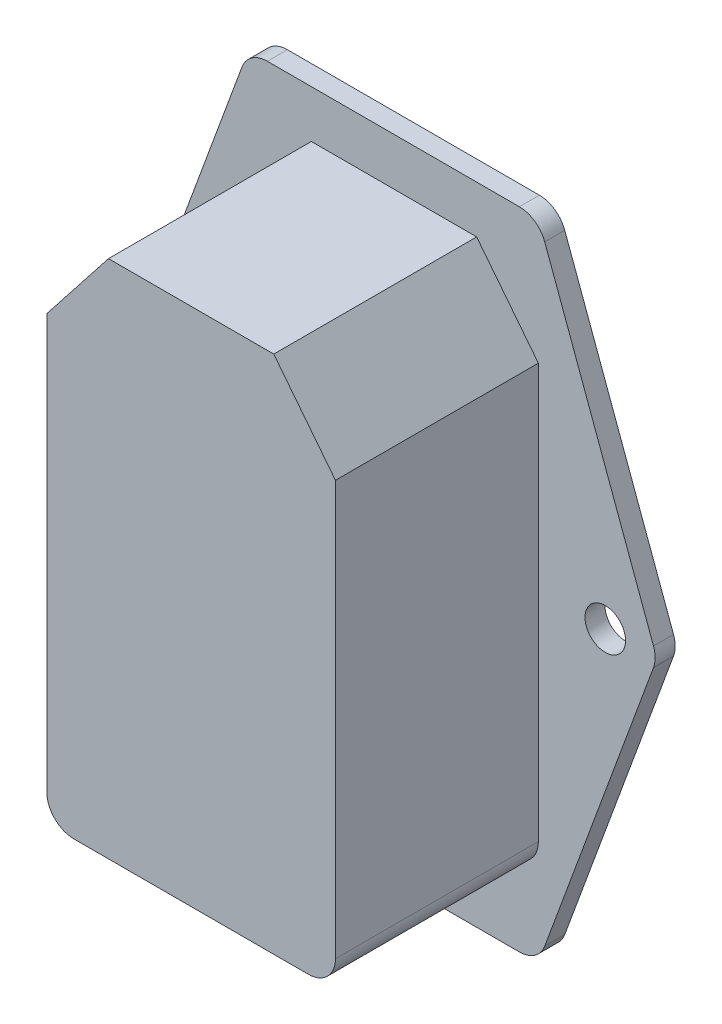
from build123d import *

# Parameters (mm, degrees)
BOSS_EXTRUDE1_DEPTH     = 19.05
BOSS_EXTRUDE2_DEPTH     = 1.8796
CUT_EXTRUDE1_DEPTH      = 22.606
CUT_EXTRUDE1_DEPTH_BACK = 20.4216
SKETCH6_R               = 1.905


with BuildPart() as part:
    # Sketch1 → Boss-Extrude1 (new body)
    with BuildSketch(Plane.XY):
        with BuildLine():
            Line((2.54, 0), (24.5618, 0))
            ThreePointArc((24.5618, 0), (26.357851224, 0.743948776), (27.1018, 2.54))
            Line((27.1018, 2.54), (27.1018, 41.4401))
            Line((27.1018, 41.4401), (21.3106, 48.809471297))
            Line((21.3106, 48.809471297), (5.7912, 48.809471297))
            Line((5.7912, 48.809471297), (0, 41.4401))
            Line((0, 41.4401), (0, 2.54))
            ThreePointArc((0, 2.54), (0.743948776, 0.743948776), (2.54, 0))
        make_face()
    extrude(amount=BOSS_EXTRUDE1_DEPTH)

    # Sketch2 → Boss-Extrude2 (add)
    with BuildSketch(Plane.XY):
        with BuildLine():
            Line((1.657581985, 53.267171297), (25.317218015, 53.267171297))
            ThreePointArc((25.317218015, 53.267171297), (26.770442849, 52.81037498), (27.700968665, 51.604287506))
            Line((27.700968665, 51.604287506), (37.914530402, 23.846751857))
            ThreePointArc((37.914530402, 23.846751857), (38.070779753, 22.969635649), (37.914530402, 22.09251944))
            Line((37.914530402, 22.09251944), (27.700968665, -5.665016208))
            ThreePointArc((27.700968665, -5.665016208), (26.770442849, -6.871103683), (25.317218015, -7.3279))
            Line((25.317218015, -7.3279), (1.657581985, -7.3279))
            ThreePointArc((1.657581985, -7.3279), (0.204357151, -6.871103683), (-0.726168665, -5.665016208))
            Line((-0.726168665, -5.665016208), (-10.939730402, 22.09251944))
            ThreePointArc((-10.939730402, 22.09251944), (-11.095979753, 22.969635649), (-10.939730402, 23.846751857))
            Line((-10.939730402, 23.846751857), (-0.726168665, 51.604287506))
            ThreePointArc((-0.726168665, 51.604287506), (0.204357151, 52.81037498), (1.657581985, 53.267171297))
        make_face()
    extrude(amount=-BOSS_EXTRUDE2_DEPTH)

    # Sketch6 → Cut-Extrude1 (cut, two sides: drawn at the far end of the back side and taken through both)
    with BuildSketch(Plane.XY.offset(-CUT_EXTRUDE1_DEPTH_BACK)):
        with Locations(Location((33.384479753, 22.969635649, 0), (0, 0, 180))):
            Circle(SKETCH6_R)
        with Locations(Location((-6.409679753, 22.969635649, 0), (0, 0, 180))):
            Circle(SKETCH6_R)
    extrude(amount=CUT_EXTRUDE1_DEPTH + CUT_EXTRUDE1_DEPTH_BACK, mode=Mode.SUBTRACT)


solid = part.part
